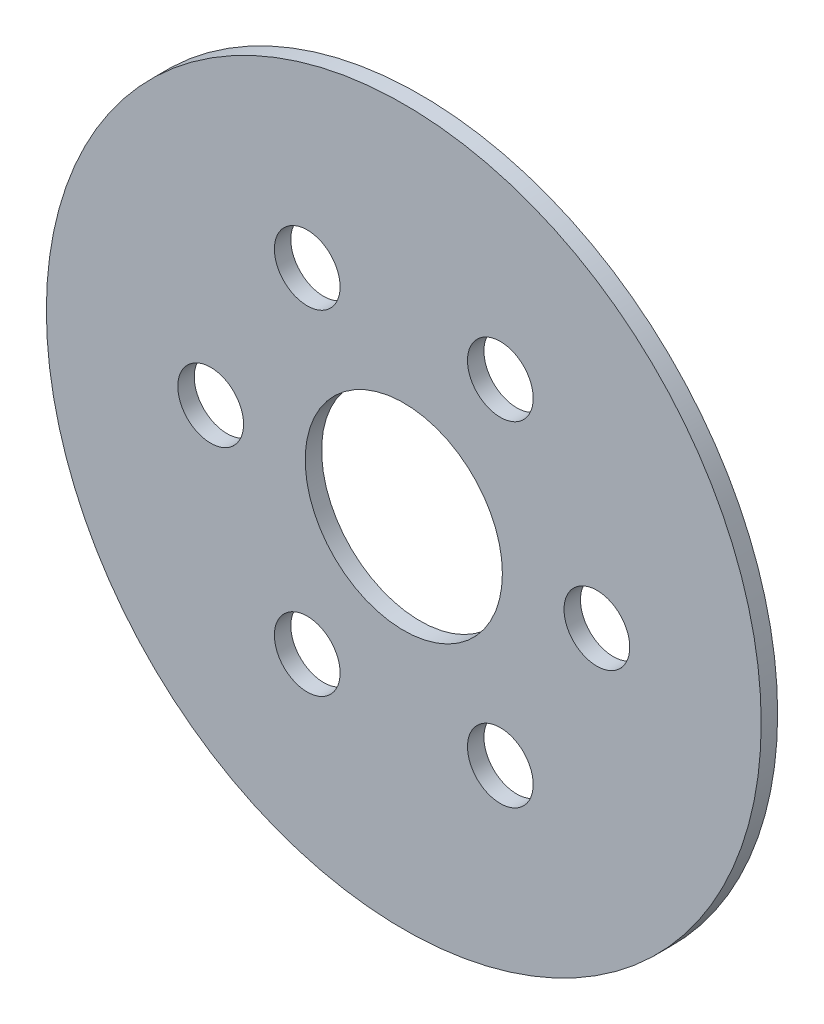
from build123d import *

# Parameters (mm, degrees)
SKIZZE1_R                       = 21.75
SKIZZE1_R_2                     = 2
SKIZZE1_R_3                     = 6
AUFSATZ_LINEAR_AUSTRAGEN1_DEPTH = 1


with BuildPart() as part:
    # Skizze1 → Aufsatz-Linear austragen1 (new body)
    with BuildSketch(Plane.XY):
        Circle(SKIZZE1_R)
        with Locations((11.75, 0)):
            Circle(SKIZZE1_R_2, mode=Mode.SUBTRACT)
        with Locations((5.875, -10.175798494)):
            Circle(SKIZZE1_R_2, mode=Mode.SUBTRACT)
        with Locations((-5.875, -10.175798494)):
            Circle(SKIZZE1_R_2, mode=Mode.SUBTRACT)
        with Locations((-11.75, 0)):
            Circle(SKIZZE1_R_2, mode=Mode.SUBTRACT)
        with Locations((-5.875, 10.175798494)):
            Circle(SKIZZE1_R_2, mode=Mode.SUBTRACT)
        with Locations((5.875, 10.175798494)):
            Circle(SKIZZE1_R_2, mode=Mode.SUBTRACT)
        Circle(SKIZZE1_R_3, mode=Mode.SUBTRACT)
    extrude(amount=AUFSATZ_LINEAR_AUSTRAGEN1_DEPTH)


solid = part.part
